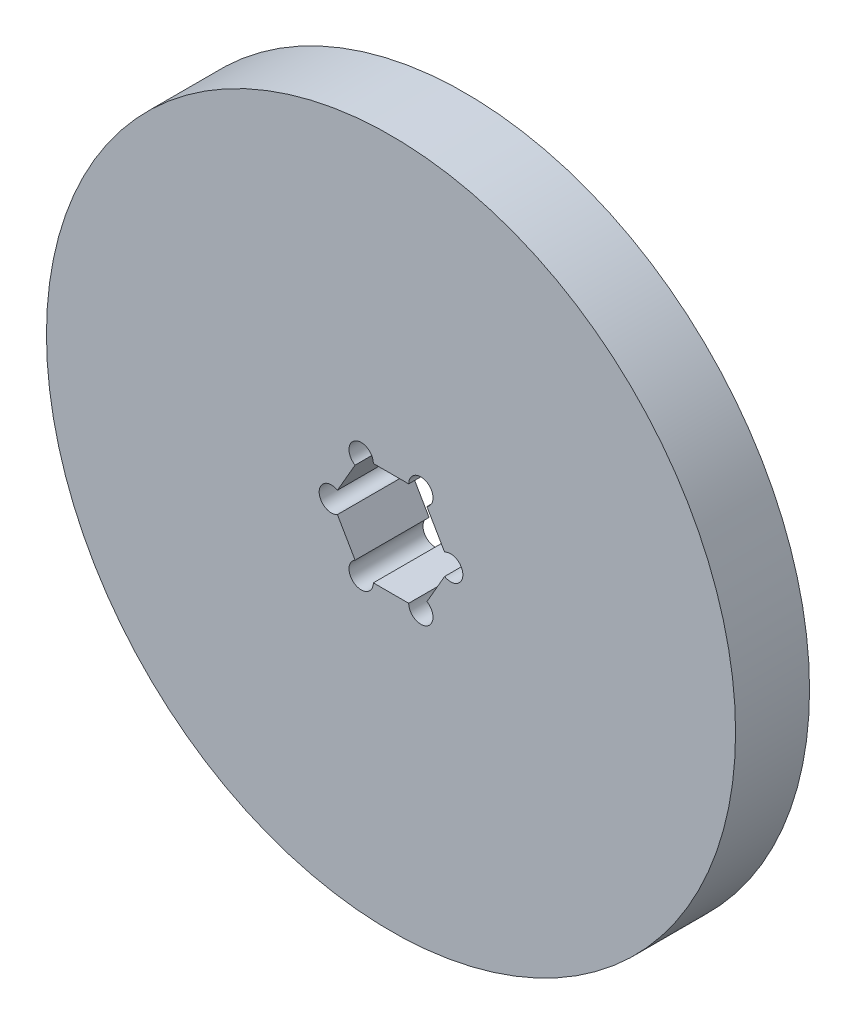
from build123d import *

# Parameters (mm, degrees)
SKETCH1_R           = 43.18
BOSS_EXTRUDE1_DEPTH = 9.271


with BuildPart() as part:
    # Sketch1 → Boss-Extrude1 (new body)
    with BuildSketch(Plane.XY):
        Circle(SKETCH1_R)
        with BuildLine():
            Line((4.501497694, 5.157177285), (6.716995387, 1.319822715))
            ThreePointArc((6.716995387, 1.319822715), (8.240995387, 1.319822715), (9.002995387, 0))
            ThreePointArc((9.002995387, 0), (8.240995387, -1.319822715), (6.716995387, -1.319822715))
            Line((6.716995387, -1.319822715), (4.501497694, -5.157177285))
            ThreePointArc((4.501497694, -5.157177285), (5.059320409, -5.715), (5.263497694, -6.477))
            ThreePointArc((5.263497694, -6.477), (3.739497694, -8.001), (2.215497694, -6.477))
            Line((2.215497694, -6.477), (-2.215497694, -6.477))
            ThreePointArc((-2.215497694, -6.477), (-4.501497694, -7.796822715), (-4.501497694, -5.157177285))
            Line((-4.501497694, -5.157177285), (-6.716995387, -1.319822715))
            ThreePointArc((-6.716995387, -1.319822715), (-9.002995387, 0), (-6.716995387, 1.319822715))
            Line((-6.716995387, 1.319822715), (-4.501497694, 5.157177285))
            ThreePointArc((-4.501497694, 5.157177285), (-4.501497694, 7.796822715), (-2.215497694, 6.477))
            Line((-2.215497694, 6.477), (2.215497694, 6.477))
            ThreePointArc((2.215497694, 6.477), (3.739497694, 8.001), (5.263497694, 6.477))
            ThreePointArc((5.263497694, 6.477), (5.059320409, 5.715), (4.501497694, 5.157177285))
        make_face(mode=Mode.SUBTRACT)
    extrude(amount=BOSS_EXTRUDE1_DEPTH)


solid = part.part
